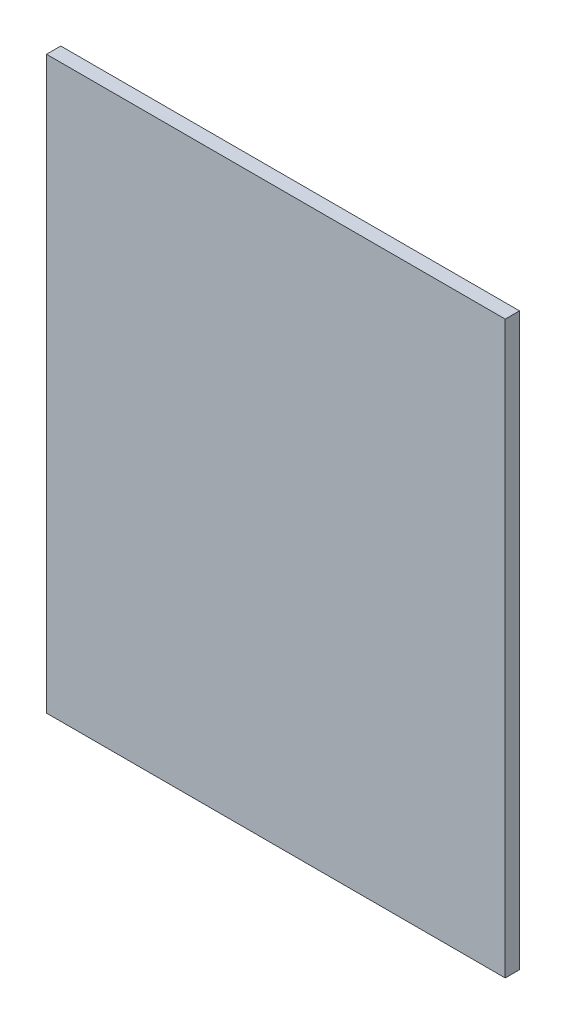
from build123d import *

# Parameters (mm, degrees)
SKETCH_1_W      = 80.390249941
SKETCH_1_H      = 2.5
EXTRUDE_1_DEPTH = 100


with BuildPart() as part:
    # Эскиз1 → Вытянуть1 (new body)
    with BuildSketch(Plane(origin=(0, 0, 0), x_dir=(1, 0, 0), z_dir=(0, 1, 0))):
        with Locations((38.201796691, -1.25)):
            Rectangle(SKETCH_1_W, SKETCH_1_H)
    extrude(amount=EXTRUDE_1_DEPTH)


solid = part.part
